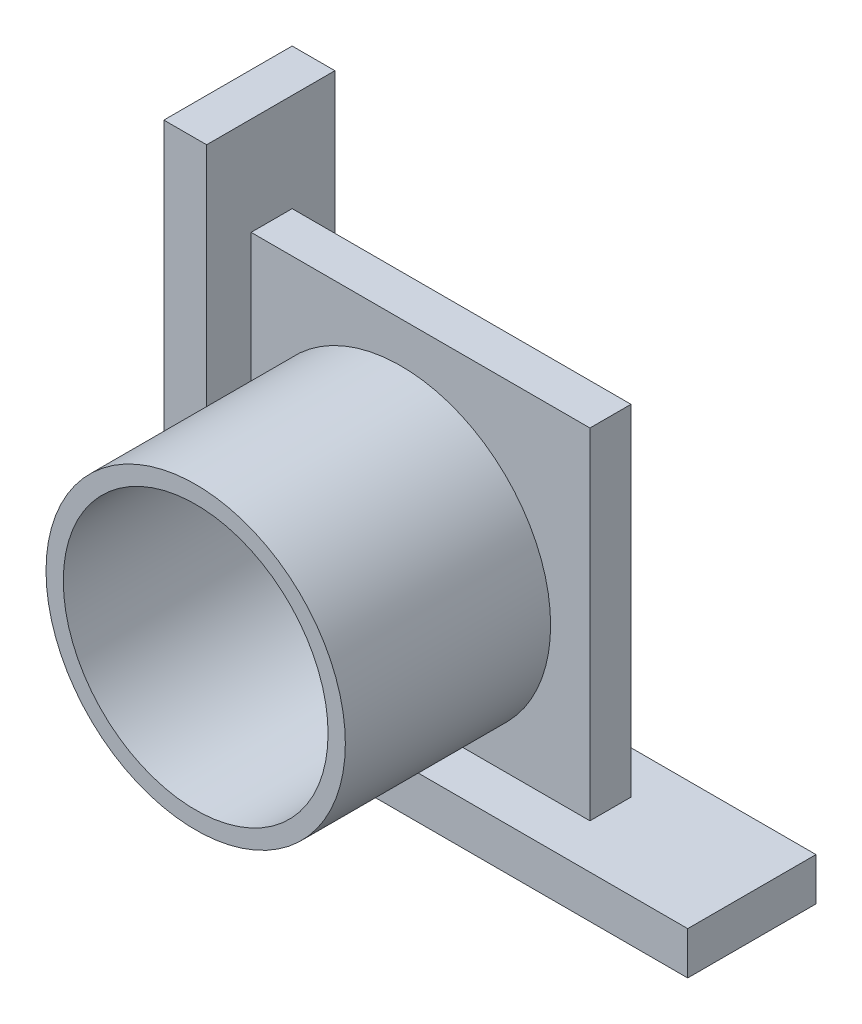
from build123d import *

# Parameters (mm, degrees)
SKETCH1_W           = 12.7
SKETCH1_H           = 38.1
BOSS_EXTRUDE1_DEPTH = 155.575
SKETCH3_W           = 12.7
SKETCH3_H           = 38.1
BOSS_EXTRUDE2_DEPTH = 130.175
SKETCH4_W           = 100.6348
SKETCH4_H           = 12.192
BOSS_EXTRUDE3_DEPTH = 101.0412
CUT_EXTRUDE2_DEPTH  = 12.192
BOSS_EXTRUDE8_START = -60.96
SKETCH6_R           = 44.45
SKETCH6_R_2         = 39.3192
BOSS_EXTRUDE8_DEPTH = 60.96


with BuildPart() as part:
    # Sketch1 → Boss-Extrude1 (new body)
    with BuildSketch(Plane(origin=(0, 0, 0), x_dir=(0, -1, 0), z_dir=(-1, 0, 0))):
        with Locations((-6.35, 19.05)):
            Rectangle(SKETCH1_W, SKETCH1_H)
    extrude(amount=-BOSS_EXTRUDE1_DEPTH)

    # Sketch3 → Boss-Extrude2 (add)
    with BuildSketch(Plane(origin=(0, 12.7, 0), x_dir=(1, 0, 0), z_dir=(0, 1, 0))):
        with Locations((6.35, -19.05)):
            Rectangle(SKETCH3_W, SKETCH3_H)
    extrude(amount=BOSS_EXTRUDE2_DEPTH)

    # Sketch4 → Boss-Extrude3 (add)
    with BuildSketch(Plane(origin=(0, 12.7, 0), x_dir=(1, 0, 0), z_dir=(0, 1, 0))):
        with Locations((63.0174, -18.796)):
            Rectangle(SKETCH4_W, SKETCH4_H)
    extrude(amount=BOSS_EXTRUDE3_DEPTH)

    # Sketch5 → Cut-Extrude2 (cut)
    with BuildSketch(Plane.XY.offset(24.892)):
        Polygon((12.7, 58.42), (58.42, 12.7), (12.7, 12.7), align=None)
    extrude(amount=-CUT_EXTRUDE2_DEPTH, mode=Mode.SUBTRACT)

    # Sketch6 → Boss-Extrude8 (add)
    with BuildSketch(Plane(origin=(0, 0, 24.892), x_dir=(-1, 0, 0), z_dir=(0, 0, -1)).offset(BOSS_EXTRUDE8_START)):
        with Locations(Location((-57.2008, 57.2008, 0), (0, 0, 180))):
            Circle(SKETCH6_R)
        with Locations(Location((-57.2008, 57.2008, 0), (0, 0, 180))):
            Circle(SKETCH6_R_2, mode=Mode.SUBTRACT)
    extrude(amount=BOSS_EXTRUDE8_DEPTH)


solid = part.part
